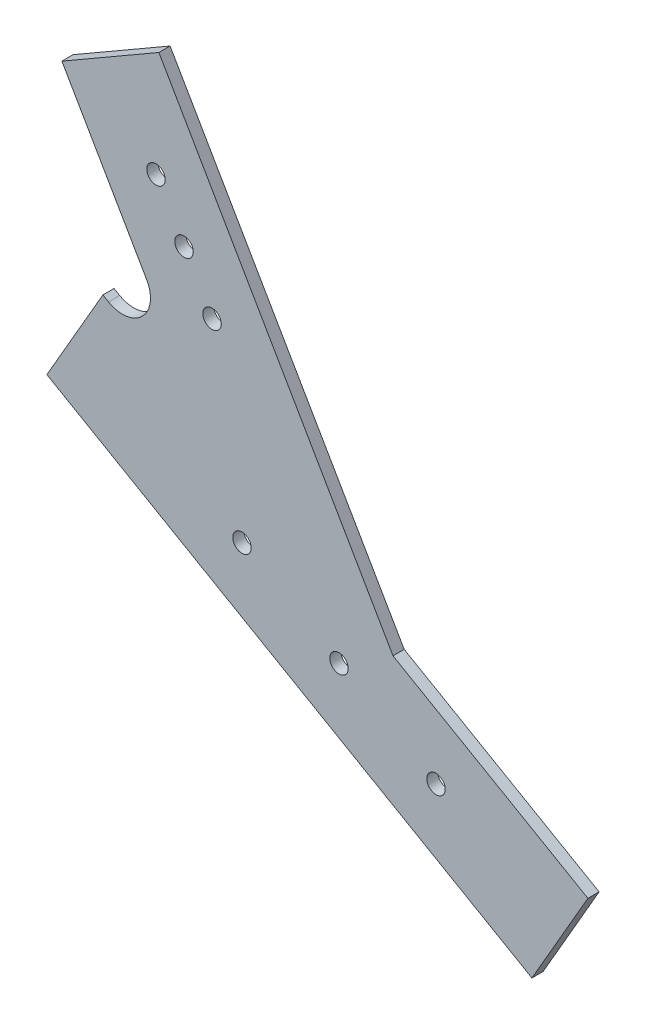
from build123d import *

# Parameters (mm, degrees)
SKETCH_1_R      = 1.65
EXTRUDE_1_DEPTH = 2


with BuildPart() as part:
    # 草图1 → 凸台-拉伸1 (new body)
    with BuildSketch(Plane.XY):
        with BuildLine():
            Line((-37.605189444, 14.746778458), (-47.605189444, -2.573729618))
            Line((-47.605189444, -2.573729618), (38.997350935, -52.573729618))
            Line((38.997350935, -52.573729618), (48.997350935, -35.253221542))
            Line((48.997350935, -35.253221542), (14.191892619, -15.158280815))
            Line((14.191892619, -15.158280815), (-27.605658614, 57.237201553))
            Line((-27.605658614, 57.237201553), (-44.926166689, 47.237201553))
            Line((-44.926166689, 47.237201553), (-29.779250551, 21.001973223))
            ThreePointArc((-29.779250551, 21.001973223), (-30.573843664, 14.966439317), (-36.60937757, 14.171846204))
            Line((-36.60937757, 14.171846204), (-37.605189444, 14.746778458))
        make_face()
        with Locations((21.870944537, -31.13878889)):
            Circle(SKETCH_1_R, mode=Mode.SUBTRACT)
        with Locations((4.550436462, -21.13878889)):
            Circle(SKETCH_1_R, mode=Mode.SUBTRACT)
        with Locations((-12.770071614, -11.13878889)):
            Circle(SKETCH_1_R, mode=Mode.SUBTRACT)
        with Locations((-18.117652306, 20.803492565)):
            Circle(SKETCH_1_R, mode=Mode.SUBTRACT)
        with Locations((-23.117652306, 29.463746603)):
            Circle(SKETCH_1_R, mode=Mode.SUBTRACT)
        with Locations((-28.117652306, 38.124000641)):
            Circle(SKETCH_1_R, mode=Mode.SUBTRACT)
    extrude(amount=EXTRUDE_1_DEPTH)


solid = part.part
